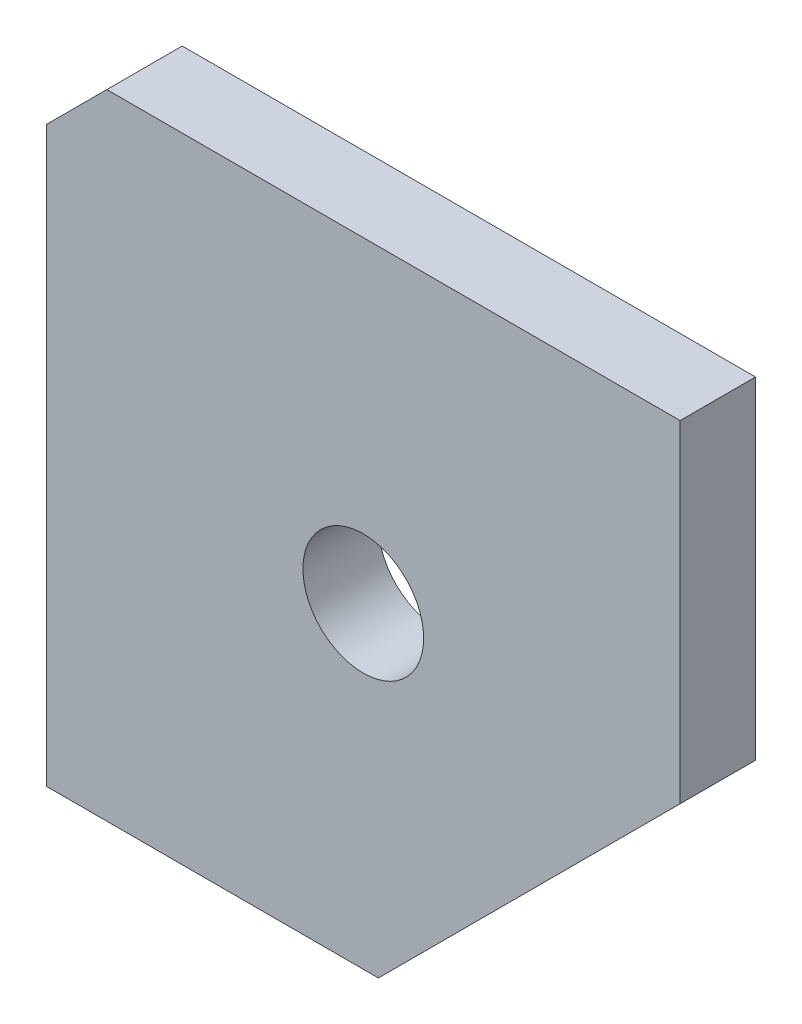
from build123d import *

# Parameters (mm, degrees)
SKETCH1_R           = 4
BOSS_EXTRUDE1_DEPTH = 5


with BuildPart() as part:
    # Sketch1 → Boss-Extrude1 (new body)
    with BuildSketch(Plane(origin=(0, 0, 0), x_dir=(-1, 0, 0), z_dir=(0, 0, -1))):
        Polygon((-21, -1), (-1, -21), (21, -21), (21, 17), (17, 21), (-21, 21), align=None)
        with Locations(Location((0, 0, 0), (0, 0, 180))):
            Circle(SKETCH1_R, mode=Mode.SUBTRACT)
    extrude(amount=-BOSS_EXTRUDE1_DEPTH)


solid = part.part
